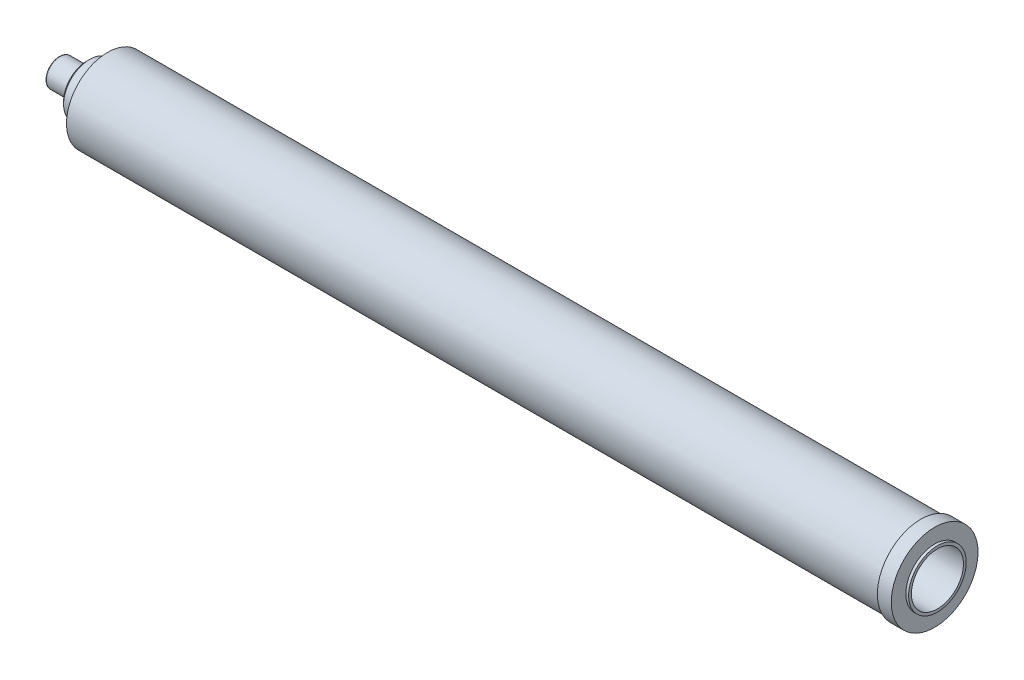
from build123d import *

# Parameters (mm, degrees)
CHAMFER1_SIZE                                       = 2.54
CSK_FOR_3_8_FLAT_HEAD_MACHINE_SCREW_100_D           = 10.0838
CSK_FOR_3_8_FLAT_HEAD_MACHINE_SCREW_100_DEPTH       = 25.4
CSK_FOR_3_8_FLAT_HEAD_MACHINE_SCREW_100_CSINK_D     = 19.3548
CSK_FOR_3_8_FLAT_HEAD_MACHINE_SCREW_100_CSINK_ANGLE = 100
CSK_FOR_3_8_FLAT_HEAD_MACHINE_SCREW_100_TIP         = 3.029479155
FILLET2_R                                           = 1.27
BOSS_EXTRUDE1_START                                 = 2.54
SKETCH5_R                                           = 26.3525
SKETCH5_R_2                                         = 23.8125
BOSS_EXTRUDE1_DEPTH                                 = 2.54
SKETCH6_R                                           = 23.8125
CUT_EXTRUDE1_DEPTH                                  = 508


with BuildPart() as part:
    # Sketch1 → Revolve1 (revolve)
    with BuildSketch(Plane.XY):
        Polygon((0, 0), (0, 12.7), (25.4, 12.7), (25.4, 23.8125), (44.45, 23.8125), (44.45, 37.6555), (788.416, 37.6555), (788.416, 39.6875), (801.116, 39.6875), (801.116, 0), align=None)
    revolve(axis=Axis((801.116, 0, 0), (-1, 0, 0)))

    # Chamfer1
    chamfer1_edges = [part.edges().sort_by_distance(p)[0] for p in [
        (25.4, -23.8125, 0),
    ]]
    chamfer(chamfer1_edges, length=CHAMFER1_SIZE)

    # CSK for 3/8 Flat Head Machine Screw (100)1
    with Locations(Plane.ZY):
        with Locations((0, 0)):
            CounterSinkHole(CSK_FOR_3_8_FLAT_HEAD_MACHINE_SCREW_100_D / 2, CSK_FOR_3_8_FLAT_HEAD_MACHINE_SCREW_100_CSINK_D / 2, depth=CSK_FOR_3_8_FLAT_HEAD_MACHINE_SCREW_100_DEPTH, counter_sink_angle=CSK_FOR_3_8_FLAT_HEAD_MACHINE_SCREW_100_CSINK_ANGLE)
            with Locations((0, 0, -(CSK_FOR_3_8_FLAT_HEAD_MACHINE_SCREW_100_DEPTH + CSK_FOR_3_8_FLAT_HEAD_MACHINE_SCREW_100_TIP / 2))):  # 118° drill point
                Cone(0, CSK_FOR_3_8_FLAT_HEAD_MACHINE_SCREW_100_D / 2, CSK_FOR_3_8_FLAT_HEAD_MACHINE_SCREW_100_TIP, mode=Mode.SUBTRACT)

    # Fillet2
    fillet2_edges = [part.edges().sort_by_distance(p)[0] for p in [
        (0, -12.7, 0),
    ]]
    fillet(fillet2_edges, radius=FILLET2_R)

    # Sketch5 → Boss-Extrude1 (add)
    with BuildSketch(Plane(origin=(801.116, 0, 0), x_dir=(0, 0, -1), z_dir=(1, 0, 0)).offset(BOSS_EXTRUDE1_START)):
        with Locations(Location((0, 0, 0), (0, 0, 90))):
            Circle(SKETCH5_R)
        with Locations(Location((0, 0, 0), (0, 0, 90))):
            Circle(SKETCH5_R_2, mode=Mode.SUBTRACT)
    extrude(amount=-BOSS_EXTRUDE1_DEPTH)

    # Sketch6 → Cut-Extrude1 (cut)
    with BuildSketch(Plane(origin=(803.656, 0, 0), x_dir=(0, 0, -1), z_dir=(1, 0, 0))):
        with Locations(Location((0, 0, 0), (0, 0, 90))):
            Circle(SKETCH6_R)
    extrude(amount=-CUT_EXTRUDE1_DEPTH, mode=Mode.SUBTRACT)


solid = part.part
